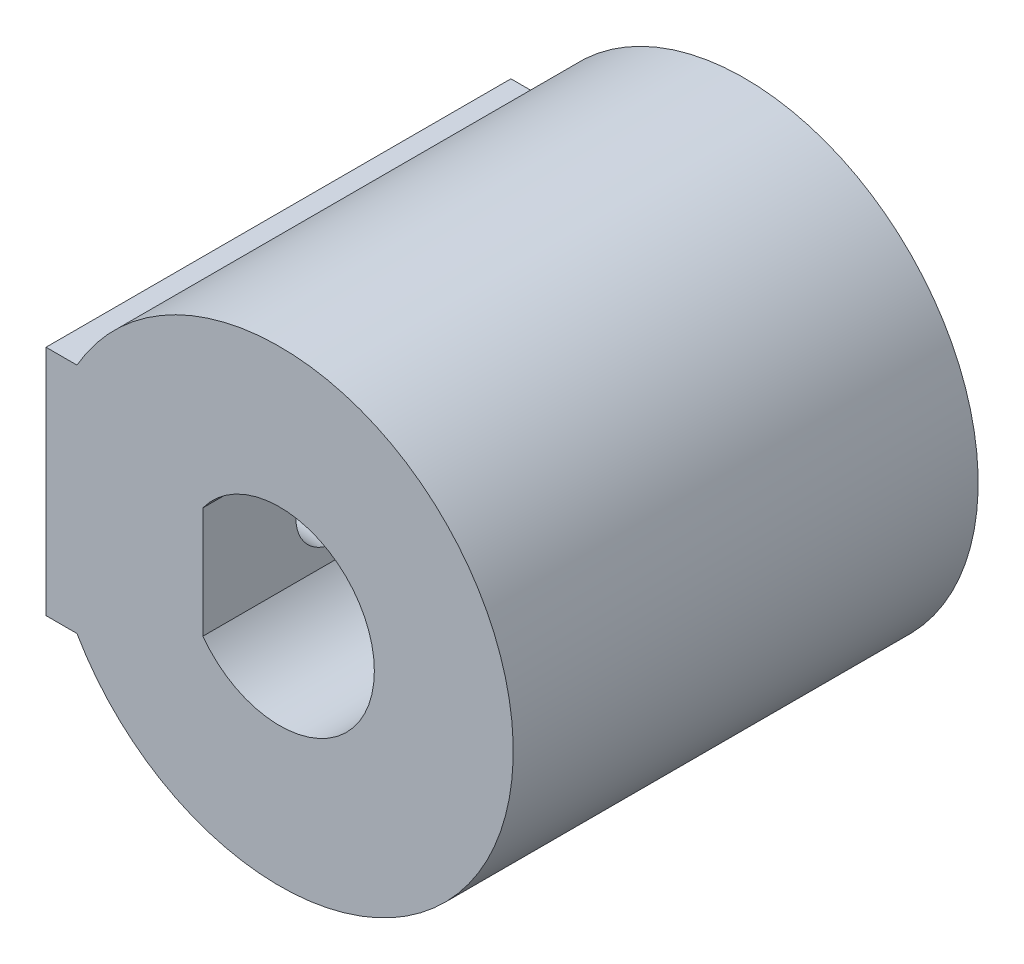
from build123d import *

# Parameters (mm, degrees)
SKETCH1_R                = 10.05
BOSS_EXTRUDE1_DEPTH      = 20
CUT_EXTRUDE2_DEPTH       = 8.5
CUT_EXTRUDE3_DEPTH       = 3
CUT_EXTRUDE1_DEPTH       = 11.5
BOSS_EXTRUDE2_REACH      = 32.083
BOSS_EXTRUDE2_END_RADIUS = 10.05
SKETCH8_W                = 20
SKETCH8_H                = 10
SKETCH6_R                = 1.75
CUT_EXTRUDE4_DEPTH       = 8.45
CUT_EXTRUDE5_REACH       = 32.083
CHAMFER1_SIZE            = 0.5


with BuildPart() as part:
    # Sketch1 → Boss-Extrude1 (new body)
    with BuildSketch(Plane.XY):
        Circle(SKETCH1_R)
    extrude(amount=BOSS_EXTRUDE1_DEPTH)

    # Sketch4 → Cut-Extrude2 (cut)
    with BuildSketch(Plane(origin=(0, 0, 0), x_dir=(-1, 0, 0), z_dir=(0, 0, -1))):
        with BuildLine():
            Line((-1.6, -2.1), (-1.6, 2.1))
            ThreePointArc((-1.6, 2.1), (0, 2.625143683), (1.6, 2.1))
            Line((1.6, 2.1), (1.6, -2.1))
            ThreePointArc((1.6, -2.1), (0, -2.625143683), (-1.6, -2.1))
        make_face()
    extrude(amount=-CUT_EXTRUDE2_DEPTH, mode=Mode.SUBTRACT)

    # Sketch5 → Cut-Extrude3 (cut)
    with BuildSketch(Plane(origin=(0, 0, 0), x_dir=(-1, 0, 0), z_dir=(0, 0, -1))):
        with BuildLine():
            Line((-1.6, -2.1), (-1.6, 2.1))
            ThreePointArc((-1.6, 2.1), (-2.640075756, 0), (-1.6, -2.1))
        make_face()
        with BuildLine():
            ThreePointArc((1.6, -2.1), (2.365810771, -1.171724966), (2.640075756, 0))
            ThreePointArc((2.640075756, 0), (2.365810771, 1.171724966), (1.6, 2.1))
            Line((1.6, 2.1), (1.6, -2.1))
        make_face()
    extrude(amount=-CUT_EXTRUDE3_DEPTH, mode=Mode.SUBTRACT)

    # Sketch3 → Cut-Extrude1 (cut)
    with BuildSketch(Plane.XY.offset(20)):
        with BuildLine():
            ThreePointArc((4.075, 0), (1.256607536, 3.876411033), (-3.3, 2.390737334))
            Line((-3.3, 2.390737334), (-3.3, -2.390737334))
            ThreePointArc((-3.3, -2.390737334), (1.256607536, -3.876411033), (4.075, 0))
        make_face()
    extrude(amount=-CUT_EXTRUDE1_DEPTH, mode=Mode.SUBTRACT)

    # Boss-Extrude2: up to this cylinder (the profile starts outside it)
    boss_extrude2_end = Plane(origin=(0, 0, 10), z_dir=(0, 0, -1)) * Cylinder(BOSS_EXTRUDE2_END_RADIUS, 85.266, mode=Mode.PRIVATE)
    # Sketch8 → Boss-Extrude2 (add, up to the surface)
    with BuildSketch(Plane.ZY.offset(10.05), mode=Mode.PRIVATE) as boss_extrude2_sk1:
        with Locations((10, 0)):
            Rectangle(SKETCH8_W, SKETCH8_H)
    boss_extrude2_tool1 = extrude(boss_extrude2_sk1.sketch, amount=-BOSS_EXTRUDE2_REACH, mode=Mode.PRIVATE) - boss_extrude2_end
    add(boss_extrude2_tool1.solids().sort_by_distance((-10.05, 0, 10))[0])
    add(boss_extrude2_tool1.solids().sort_by_distance((-10.05, 0, 10))[1])

    # Sketch6 → Cut-Extrude4 (cut)
    with BuildSketch(Plane.ZY.offset(10.05)):
        with Locations((5.75, 0)):
            Circle(SKETCH6_R)
    extrude(amount=-CUT_EXTRUDE4_DEPTH, mode=Mode.SUBTRACT)

    # Sketch7 → Cut-Extrude5 (cut, up to next)
    with BuildSketch(Plane.ZY.offset(10.05), mode=Mode.PRIVATE) as cut_extrude5_sk1:
        with BuildLine():
            ThreePointArc((16, 0), (14.25, 1.75), (12.5, 0))
            Line((12.5, 0), (16, 0))
        make_face()
    cut_extrude5_tool1 = extrude(cut_extrude5_sk1.sketch, amount=-CUT_EXTRUDE5_REACH, mode=Mode.PRIVATE) & part.part
    # Sketch7 → Cut-Extrude5 (cut, up to next)
    with BuildSketch(Plane.ZY.offset(10.05), mode=Mode.PRIVATE) as cut_extrude5_sk2:
        with BuildLine():
            Line((16, 0), (12.5, 0))
            ThreePointArc((12.5, 0), (14.25, -1.75), (16, 0))
        make_face()
    cut_extrude5_tool2 = extrude(cut_extrude5_sk2.sketch, amount=-CUT_EXTRUDE5_REACH, mode=Mode.PRIVATE) & part.part
    # Sketch7 → Cut-Extrude5 (cut, up to next)
    with BuildSketch(Plane.ZY.offset(10.05), mode=Mode.PRIVATE) as cut_extrude5_sk3:
        with BuildLine():
            ThreePointArc((16, 0), (14.25, 1.75), (12.5, 0))
            Line((12.5, 0), (16, 0))
        make_face()
    cut_extrude5_tool3 = extrude(cut_extrude5_sk3.sketch, amount=-CUT_EXTRUDE5_REACH, mode=Mode.PRIVATE) & part.part
    # Sketch7 → Cut-Extrude5 (cut, up to next)
    with BuildSketch(Plane.ZY.offset(10.05), mode=Mode.PRIVATE) as cut_extrude5_sk4:
        with BuildLine():
            Line((16, 0), (12.5, 0))
            ThreePointArc((12.5, 0), (14.25, -1.75), (16, 0))
        make_face()
    cut_extrude5_tool4 = extrude(cut_extrude5_sk4.sketch, amount=-CUT_EXTRUDE5_REACH, mode=Mode.PRIVATE) & part.part
    add(cut_extrude5_tool1.solids().sort_by_distance((-10.05, 0.742723, 14.25))[0], mode=Mode.SUBTRACT)
    add(cut_extrude5_tool2.solids().sort_by_distance((-10.05, -0.742723, 14.25))[0], mode=Mode.SUBTRACT)
    add(cut_extrude5_tool3.solids().sort_by_distance((-10.05, 0.742723, 14.25))[0], mode=Mode.SUBTRACT)
    add(cut_extrude5_tool4.solids().sort_by_distance((-10.05, -0.742723, 14.25))[0], mode=Mode.SUBTRACT)

    # Chamfer1
    chamfer1_edges = [part.edges().sort_by_distance(p)[0] for p in [
        (-10.05, 0, 4),
        (-10.05, 0, 12.5),
    ]]
    chamfer(chamfer1_edges, length=CHAMFER1_SIZE)


solid = part.part
